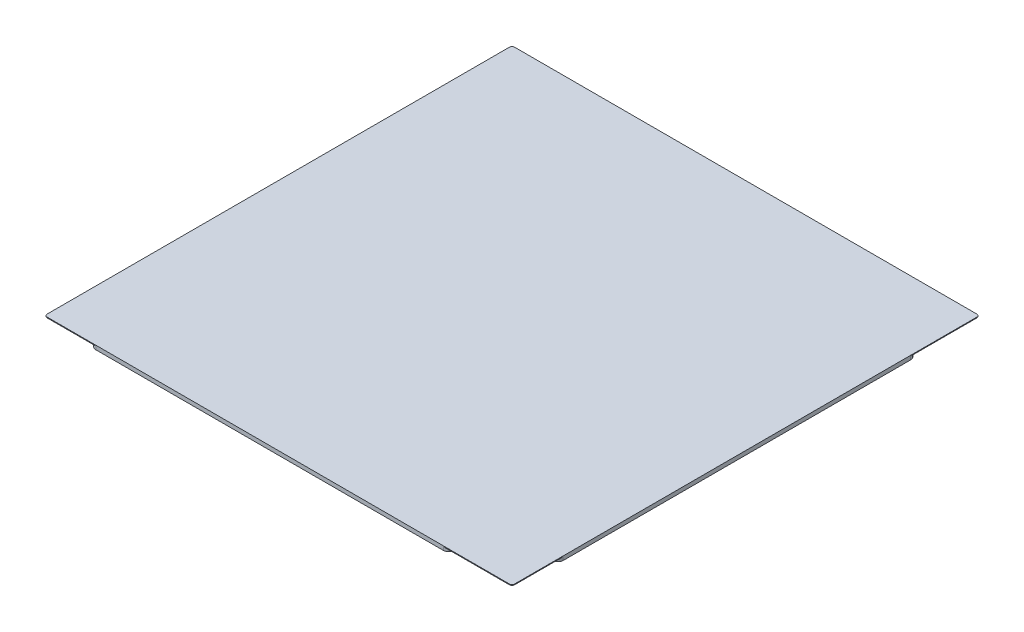
from build123d import *

# Parameters (mm, degrees)
SKETCH1_W           = 187
SKETCH1_H           = 187
BOSS_EXTRUDE1_DEPTH = 0.15
SKETCH2_W           = 13.5
SKETCH2_H           = 143
SKETCH2_W_2         = 143
SKETCH2_H_2         = 13.5
BOSS_EXTRUDE2_DEPTH = 1.3
FILLET1_R           = 2
FILLET2_R           = 1


with BuildPart() as part:
    # Sketch1 → Boss-Extrude1 (new, symmetric)
    with BuildSketch(Plane(origin=(0, 0, 0), x_dir=(1, 0, 0), z_dir=(0, 1, 0))):
        Rectangle(SKETCH1_W, SKETCH1_H)
    extrude(amount=BOSS_EXTRUDE1_DEPTH, both=True)

    # Sketch2 → Boss-Extrude2 (add)
    with BuildSketch(Plane.XZ.offset(0.15)):
        with Locations((-86.75, -3.5)):
            Rectangle(SKETCH2_W, SKETCH2_H)
        with Locations((3.5, -86.75)):
            Rectangle(SKETCH2_W_2, SKETCH2_H_2)
        with Locations((-3.5, 86.75)):
            Rectangle(SKETCH2_W_2, SKETCH2_H_2)
        with Locations((86.75, 3.5)):
            Rectangle(SKETCH2_W, SKETCH2_H)
    extrude(amount=BOSS_EXTRUDE2_DEPTH)

    # Fillet1
    fillet1_edges = [part.edges().sort_by_distance(p)[0] for p in [
        (75, -0.8, -93.5),
        (75, -0.8, -80),
        (-68, -0.8, -80),
        (-68, -0.8, -93.5),
        (-80, -0.8, -75),
        (-80, -0.8, 68),
        (-93.5, -0.8, 68),
        (-93.5, -0.8, -75),
        (-75, -0.8, 80),
        (68, -0.8, 80),
        (68, -0.8, 93.5),
        (-75, -0.8, 93.5),
        (80, -0.8, 75),
        (80, -0.8, -68),
        (93.5, -0.8, -68),
        (93.5, -0.8, 75),
    ]]
    fillet(fillet1_edges, radius=FILLET1_R)

    # Fillet2
    fillet2_edges = [part.edges().sort_by_distance(p)[0] for p in [
        (93.5, 0, 93.5),
        (-93.5, 0, 93.5),
        (-93.5, 0, -93.5),
        (93.5, 0, -93.5),
    ]]
    fillet(fillet2_edges, radius=FILLET2_R)


solid = part.part
